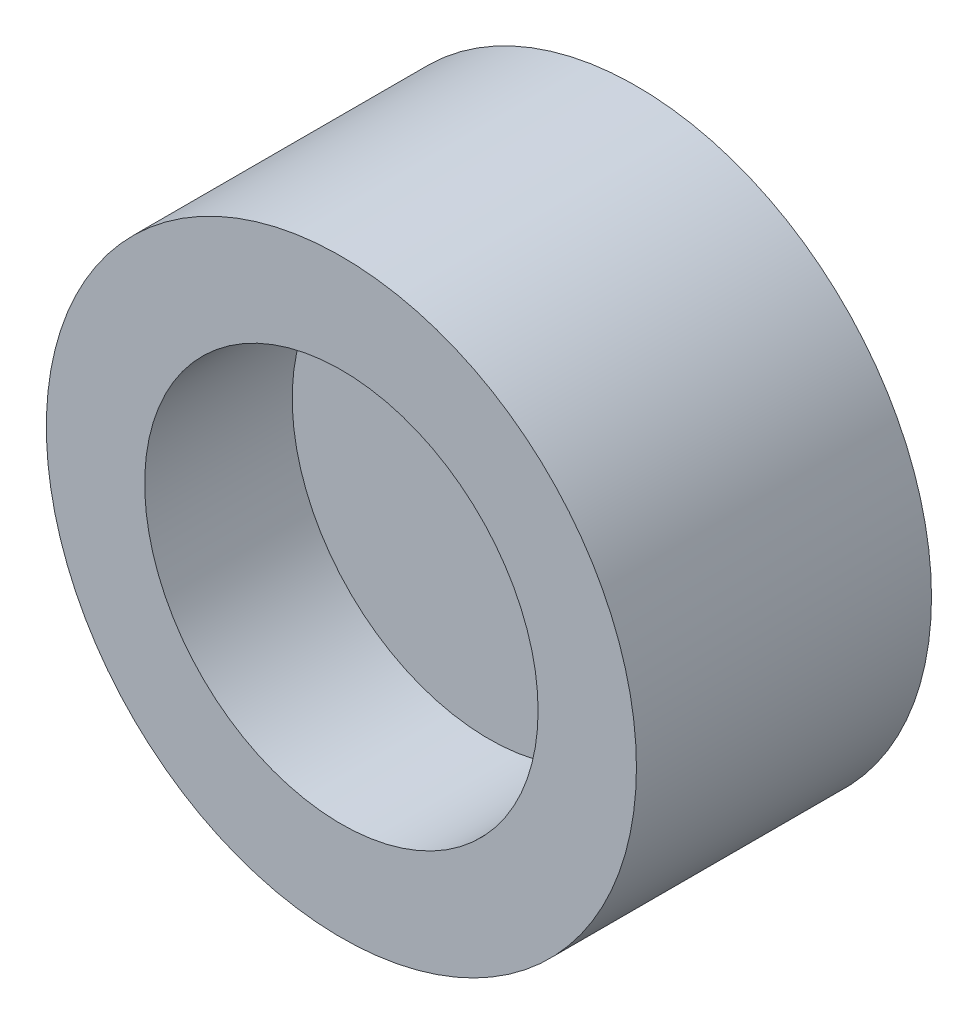
from build123d import *

# Parameters (mm, degrees)
SKETCH_1_R          = 3
EXTRUDE_1_DEPTH     = 3
SKETCH_2_R          = 2
CUT_EXTRUDE_1_DEPTH = 1.5


with BuildPart() as part:
    # Эскиз1 → Бобышка-Вытянуть1 (new body)
    with BuildSketch(Plane.XY):
        Circle(SKETCH_1_R)
    extrude(amount=EXTRUDE_1_DEPTH)

    # Эскиз2 → Вырез-Вытянуть1 (cut)
    with BuildSketch(Plane.XY.offset(3)):
        Circle(SKETCH_2_R)
    extrude(amount=-CUT_EXTRUDE_1_DEPTH, mode=Mode.SUBTRACT)


solid = part.part
